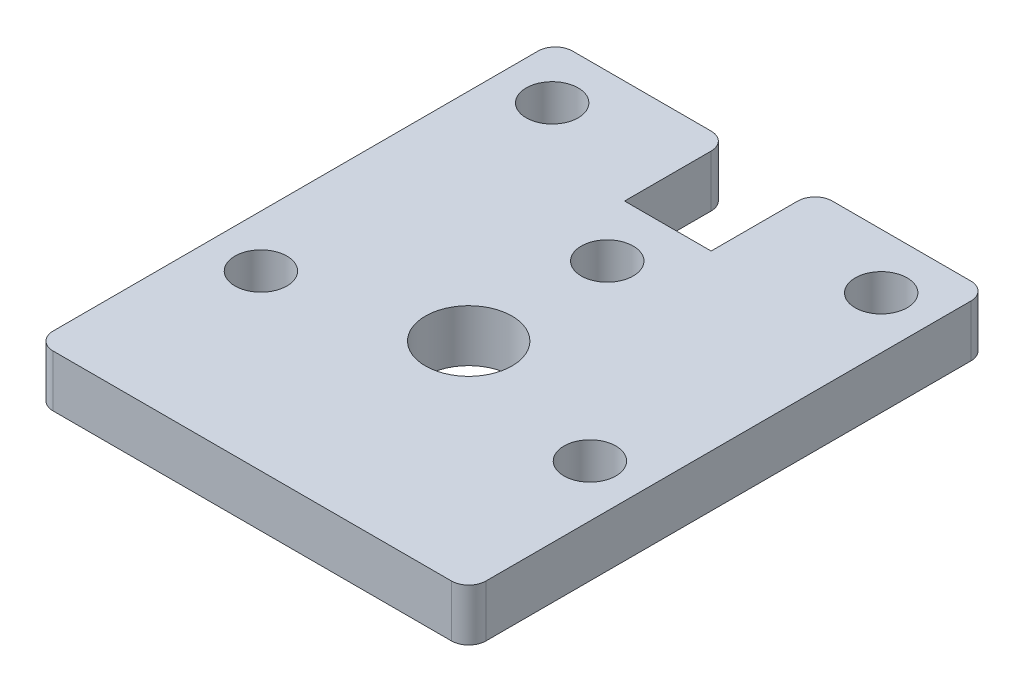
from build123d import *

# Parameters (mm, degrees)
SKETCH1_W           = 25
SKETCH1_H           = 30
SKETCH1_R           = 1.5
BOSS_EXTRUDE1_DEPTH = 3
SKETCH2_R           = 1.5
SKETCH2_R_2         = 2.5
SKETCH2_W           = 5
SKETCH2_H           = 6
CUT_EXTRUDE1_DEPTH  = 40.166312055
FILLET2_R           = 1


with BuildPart() as part:
    # Sketch1 → Boss-Extrude1 (new body)
    with BuildSketch(Plane(origin=(0, 0, 0), x_dir=(1, 0, 0), z_dir=(0, 1, 0))):
        with Locations((12.5, -15)):
            Rectangle(SKETCH1_W, SKETCH1_H)
        with Locations(Location((3, -20, 0), (0, 0, 270))):
            Circle(SKETCH1_R, mode=Mode.SUBTRACT)
        with Locations(Location((22, -20, 0), (0, 0, 270))):
            Circle(SKETCH1_R, mode=Mode.SUBTRACT)
        with Locations(Location((22, -3.18, 0), (0, 0, 270))):
            Circle(SKETCH1_R, mode=Mode.SUBTRACT)
        with Locations(Location((3, -3.18, 0), (0, 0, 270))):
            Circle(SKETCH1_R, mode=Mode.SUBTRACT)
    extrude(amount=BOSS_EXTRUDE1_DEPTH)

    # Sketch2 → Cut-Extrude1 (cut, through all)
    with BuildSketch(Plane(origin=(0, 3, 0), x_dir=(1, 0, 0), z_dir=(0, 1, 0))):
        with Locations(Location((12.5, -9.5, 0), (0, 0, 270))):
            Circle(SKETCH2_R)
        with Locations(Location((12.5, -17.5, 0), (0, 0, 270))):
            Circle(SKETCH2_R_2)
        with Locations((12.5, -3)):
            Rectangle(SKETCH2_W, SKETCH2_H)
    extrude(amount=-CUT_EXTRUDE1_DEPTH, mode=Mode.SUBTRACT)

    # Fillet2
    fillet2_edges = [part.edges().sort_by_distance(p)[0] for p in [
        (10, 1.5, 0),
        (15, 1.5, 0),
        (0, 1.5, 0),
        (25, 1.5, 0),
        (25, 1.5, 30),
        (0, 1.5, 30),
    ]]
    fillet(fillet2_edges, radius=FILLET2_R)


solid = part.part
